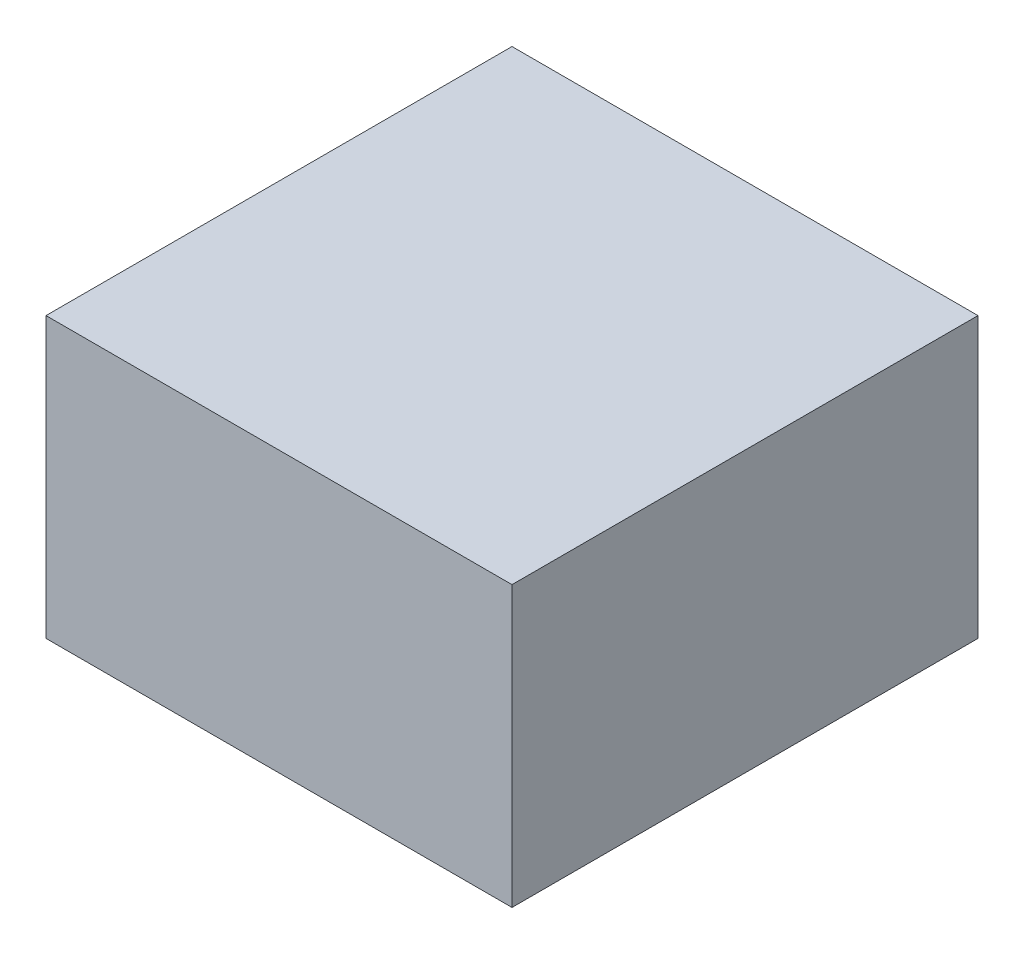
from build123d import *

# Parameters (mm, degrees)
SKETCH1_W           = 12.7
SKETCH1_H           = 12.7
BOSS_EXTRUDE1_DEPTH = 7.62


with BuildPart() as part:
    # Sketch1 → Boss-Extrude1 (new body)
    with BuildSketch(Plane(origin=(0, 0, 0), x_dir=(1, 0, 0), z_dir=(0, 1, 0))):
        Rectangle(SKETCH1_W, SKETCH1_H)
    extrude(amount=BOSS_EXTRUDE1_DEPTH)


solid = part.part
